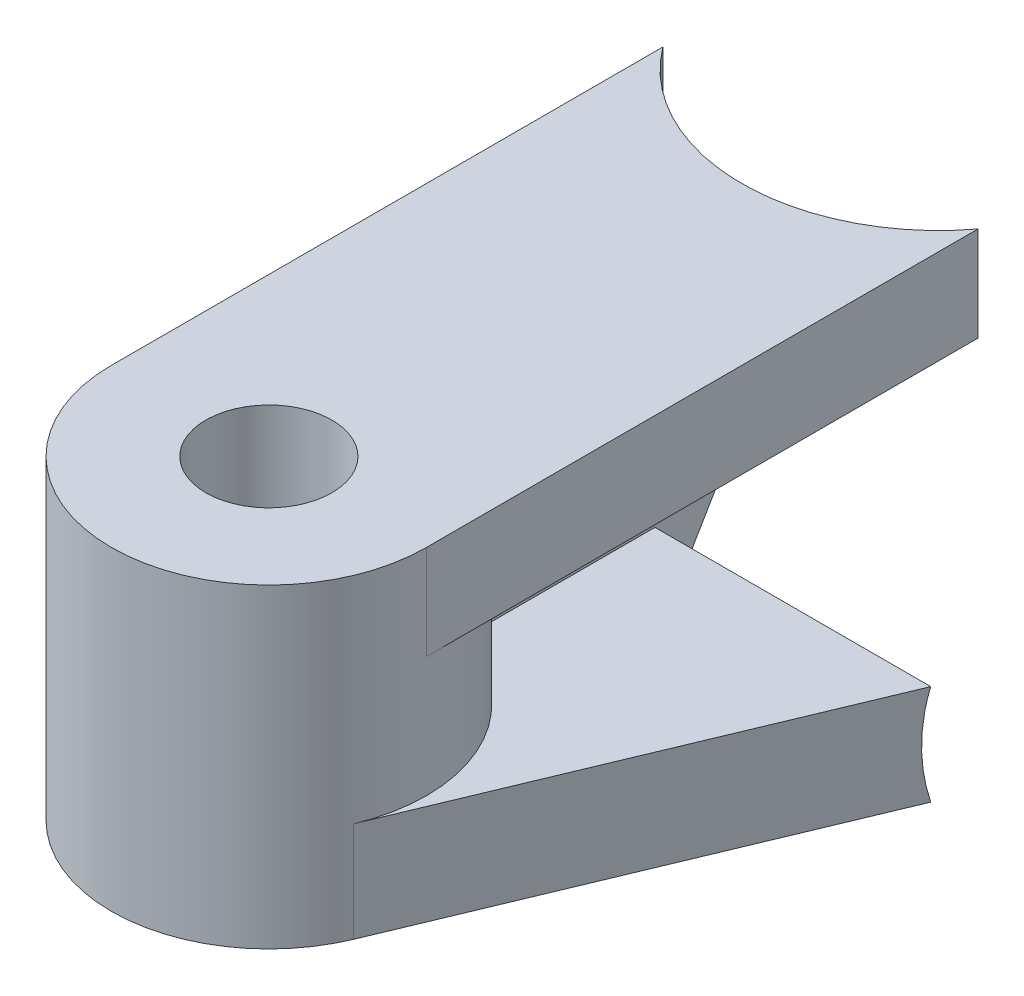
from build123d import *

# Parameters (mm, degrees)
BOSS_EXTRUDE1_DEPTH = 6.35
SKETCH1_3_R         = 4
BOSS_EXTRUDE2_DEPTH = 20
SKETCH2_R           = 12.5
CUT_EXTRUDE1_DEPTH  = 55.990908339
BOSS_EXTRUDE3_START = -6
BOSS_EXTRUDE3_DEPTH = 6


with BuildPart() as part:
    # Sketch1 → Boss-Extrude1 (new body)
    with BuildSketch(Plane(origin=(0, 0, 0), x_dir=(1, 0, 0), z_dir=(0, 1, 0))):
        with BuildLine():
            Line((40, 0), (0, 0))
            Line((0, 0), (10.769230769, -25.846153846))
            ThreePointArc((10.769230769, -25.846153846), (18.038838649, -12.194193243), (30, -22))
            ThreePointArc((30, -22), (29.805806757, -23.961161351), (29.230769231, -25.846153846))
            Line((29.230769231, -25.846153846), (40, 0))
        make_face()
    extrude(amount=BOSS_EXTRUDE1_DEPTH)

    # Sketch1<3> → Boss-Extrude2 (add)
    with BuildSketch(Plane(origin=(0, 0, 0), x_dir=(1, 0, 0), z_dir=(0, 1, 0))):
        with BuildLine():
            ThreePointArc((30, -22), (18.038838649, -12.194193243), (10.769230769, -25.846153846))
            ThreePointArc((10.769230769, -25.846153846), (20, -32), (29.230769231, -25.846153846))
            ThreePointArc((29.230769231, -25.846153846), (29.805806757, -23.961161351), (30, -22))
        make_face()
        with Locations((20, -22)):
            Circle(SKETCH1_3_R, mode=Mode.SUBTRACT)
    extrude(amount=BOSS_EXTRUDE2_DEPTH)

    # Sketch2 → Cut-Extrude1 (cut, through all)
    with BuildSketch(Plane(origin=(0, 0, 0), x_dir=(0, 0, -1), z_dir=(1, 0, 0))):
        with Locations((12.090052729, 3.175)):
            Circle(SKETCH2_R)
    extrude(amount=CUT_EXTRUDE1_DEPTH, mode=Mode.SUBTRACT)

    # Sketch3 → Boss-Extrude3 (add)
    with BuildSketch(Plane(origin=(0, 20, 0), x_dir=(1, 0, 0), z_dir=(0, 1, 0)).offset(BOSS_EXTRUDE3_START)):
        with BuildLine():
            Line((10, 13), (10, -22))
            ThreePointArc((10, -22), (20, -12), (30, -22))
            Line((30, -22), (30, 13))
            ThreePointArc((30, 13), (20, 8), (10, 13))
        make_face()
    extrude(amount=BOSS_EXTRUDE3_DEPTH)

    # Sketch5 for Loft1 → Loft1 section 0
    with BuildSketch(Plane.XZ):
        with BuildLine():
            Line((22.5, 0), (17.5, 0))
            Line((17.5, 0), (17.5, 12.317541634))
            # circular arc as an exact rational Bezier (weights 1, cos(half-angle), 1)
            Bezier((17.5, 12.317541634), (20, 11.67204441), (22.5, 12.317541634), weights=[1, 0.968245837, 1])
            Line((22.5, 12.317541634), (22.5, 0))
        make_face()
    # Sketch4 for Loft1 → Loft1 section 1
    with BuildSketch(Plane.XZ.offset(-14)):
        with BuildLine():
            Line((17.5, -8.252551286), (17.5, 12.317541634))
            Bezier((17.5, 12.317541634), (20, 11.67204441), (22.5, 12.317541634), weights=[1, 0.968245837, 1])
            Line((22.5, 12.317541634), (22.5, -8.252551286))
            Bezier((22.5, -8.252551286), (20, -7.742240923), (17.5, -8.252551286), weights=[1, 0.979795897, 1])
        make_face()
    loft()


solid = part.part
